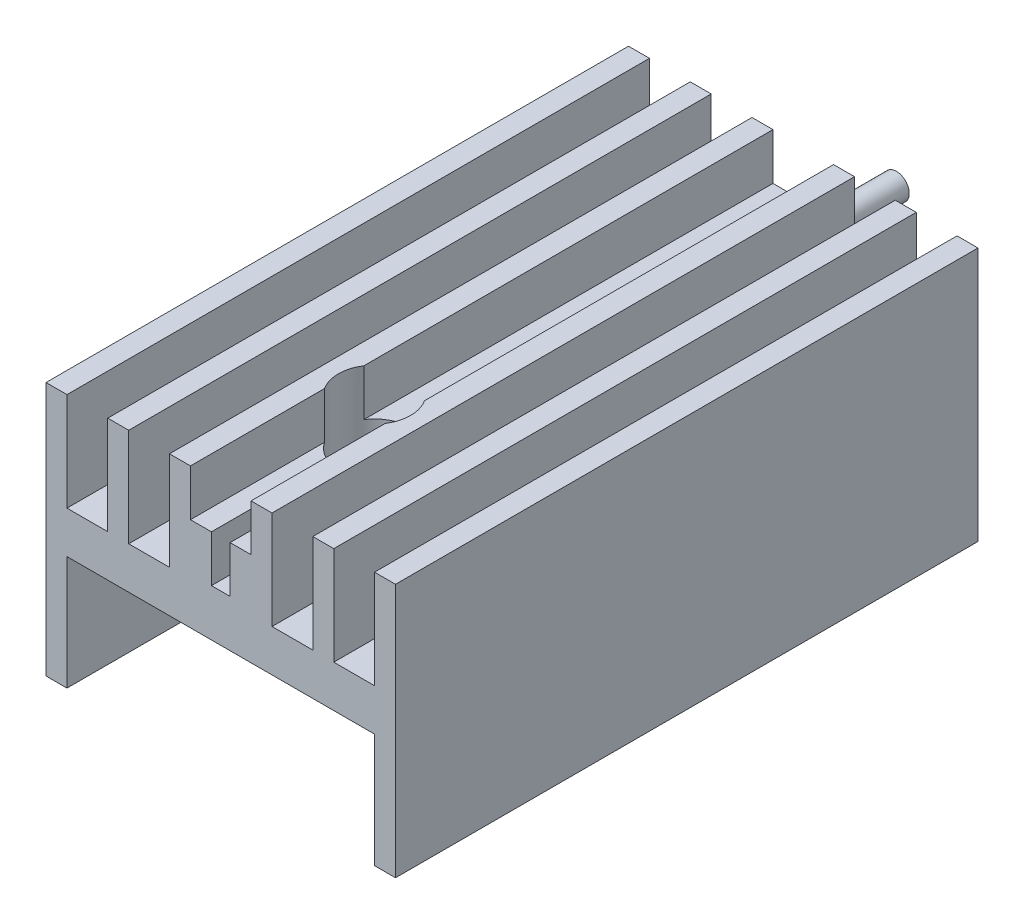
from build123d import *

# Parameters (mm, degrees)
BOSS_EXTRUDE1_DEPTH      = 12.5
SKETCH3_R                = 1.55
CUT_EXTRUDE1_DEPTH       = 25
BOSS_EXTRUDE4_DEPTH      = 4
BOSS_EXTRUDE4_DEPTH_BACK = 6
SKETCH4_R                = 0.55


with BuildPart() as part:
    # Sketch2 → Boss-Extrude1 (new, symmetric)
    with BuildSketch(Plane.XY):
        Polygon((-6.6, -0.565), (-6.6, -5.455), (-7.5, -5.455), (-7.5, 5.455), (-6.6, 5.455), (-6.6, 1.235), (-4.85, 1.235), (-4.85, 5.455), (-3.95, 5.455), (-3.95, 1.235), (-2.2, 1.235), (-2.2, 5.455), (-1.3, 5.455), (-1.3, 3.455), (-0.4, 3.455), (-0.4, 1.455), (0.4, 1.455), (0.4, 3.455), (1.3, 3.455), (1.3, 5.455), (2.2, 5.455), (2.2, 1.235), (3.95, 1.235), (3.95, 5.455), (4.85, 5.455), (4.85, 1.235), (6.6, 1.235), (6.6, 5.455), (7.5, 5.455), (7.5, -5.455), (6.6, -5.455), (6.6, -0.565), align=None)
    extrude(amount=BOSS_EXTRUDE1_DEPTH, both=True)

    # Sketch3 → Cut-Extrude1 (cut)
    with BuildSketch(Plane.XZ.offset(0.565)):
        with Locations((0, 5.9)):
            Circle(SKETCH3_R)
    extrude(amount=-CUT_EXTRUDE1_DEPTH, mode=Mode.SUBTRACT)


with BuildPart() as body_2:
    # Sketch4 → Boss-Extrude4 (new, two sides: drawn at the far end of the back side and taken through both)
    with BuildSketch(Plane(origin=(0, 0, -12.5), x_dir=(-1, 0, 0), z_dir=(0, 0, -1)).offset(-BOSS_EXTRUDE4_DEPTH_BACK)):
        with Locations((0, 2.005)):
            Circle(SKETCH4_R)
    extrude(amount=BOSS_EXTRUDE4_DEPTH + BOSS_EXTRUDE4_DEPTH_BACK)


solid = Compound([part.part, body_2.part])
